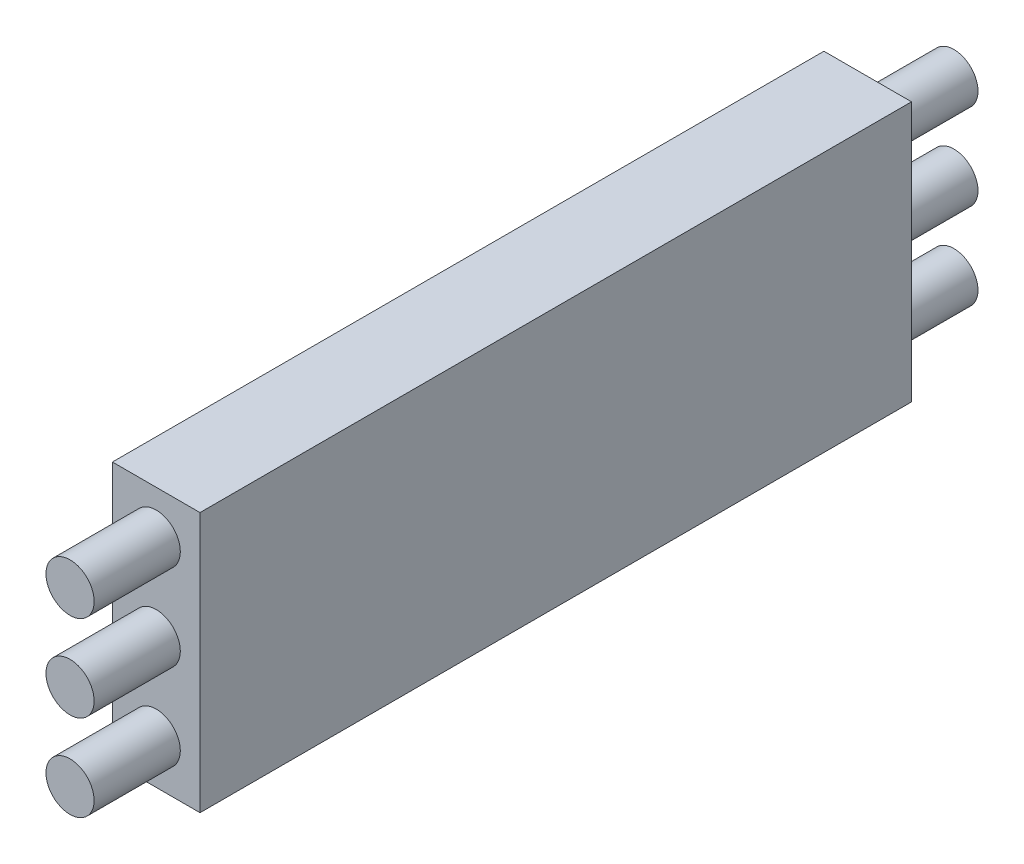
from build123d import *

# Parameters (mm, degrees)
SKETCH1_R             = 2.794
BOSS_EXTRUDE1_DEPTH   = 10
BOSS_EXTRUDE1_2_DEPTH = 10
BOSS_EXTRUDE1_3_DEPTH = 10
SKETCH2_W             = 10.16
SKETCH2_H             = 30.16
BOSS_EXTRUDE2_DEPTH   = 82.55
BOSS_EXTRUDE3_START   = 10
SKETCH3_R             = 2.794
BOSS_EXTRUDE3_DEPTH   = 10


with BuildPart() as part:
    # Sketch1 → Boss-Extrude1 (new body)
    with BuildSketch(Plane.XY):
        with Locations((110, 20)):
            Circle(SKETCH1_R)
    extrude(amount=-BOSS_EXTRUDE1_DEPTH)



with BuildPart() as body_2:
    # Sketch1 → Boss-Extrude1 2 (new body)
    with BuildSketch(Plane.XY):
        with Locations((110, 10)):
            Circle(SKETCH1_R)
    extrude(amount=-BOSS_EXTRUDE1_2_DEPTH)


with BuildPart() as body_3:
    # Sketch1 → Boss-Extrude1 3 (new body)
    with BuildSketch(Plane.XY):
        with Locations((110, 30)):
            Circle(SKETCH1_R)
    extrude(amount=-BOSS_EXTRUDE1_3_DEPTH)


with BuildPart() as part_1:
    add(part.part)

    add(body_2.part)  # Boss-Extrude2 merges body 2

    add(body_3.part)  # Boss-Extrude2 merges body 3
    # Sketch2 → Boss-Extrude2 (add)
    with BuildSketch(Plane.XY):
        with Locations((110, 20)):
            Rectangle(SKETCH2_W, SKETCH2_H)
    extrude(amount=BOSS_EXTRUDE2_DEPTH)

    # Sketch3 → Boss-Extrude3 (add)
    with BuildSketch(Plane.XY.offset(82.55).offset(BOSS_EXTRUDE3_START)):
        with Locations((110, 10)):
            Circle(SKETCH3_R)
        with Locations((110, 20)):
            Circle(SKETCH3_R)
        with Locations((110, 30)):
            Circle(SKETCH3_R)
    extrude(amount=-BOSS_EXTRUDE3_DEPTH)


solid = part_1.part
